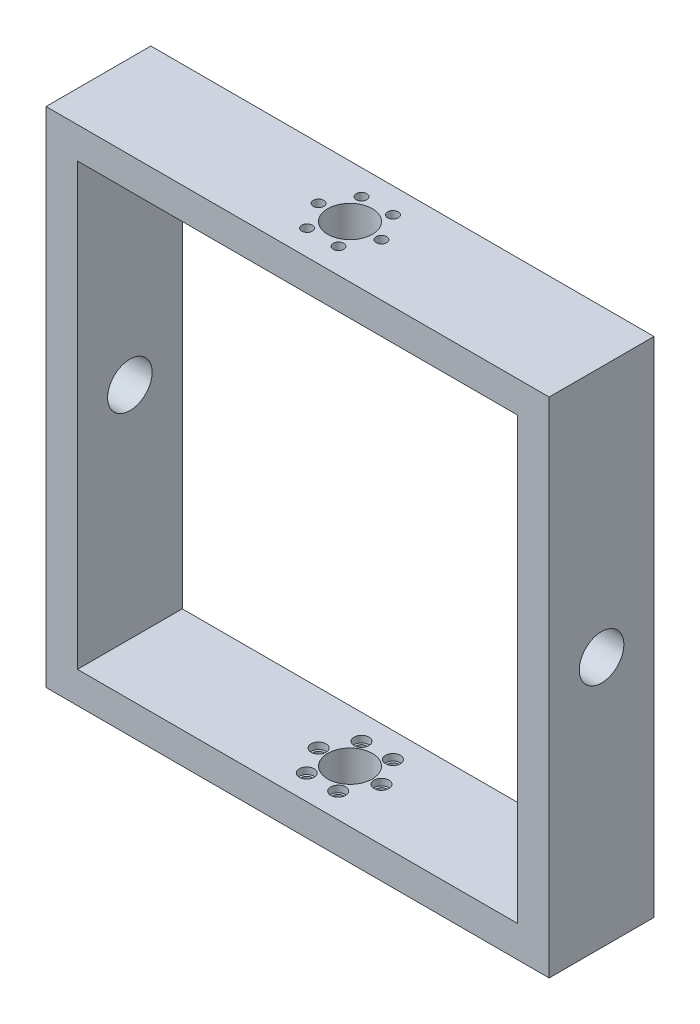
from build123d import *

# Parameters (mm, degrees)
BOSS_EXTRUDE1_DEPTH            = 76.2
BOSS_EXTRUDE1_DEPTH_BACK       = 76.2
SKETCH3_W                      = 152.4
SKETCH3_H                      = 152.4
SKETCH3_W_2                    = 133.35
SKETCH3_H_2                    = 133.35
SKETCH6_W                      = 152.4
SKETCH6_H                      = 120.65
CUT_EXTRUDE1_DEPTH             = 187.6511184
M12_CLEARANCE_HOLE1_D          = 13.5
M12_CLEARANCE_HOLE2_D          = 13.5
CBORE_FOR_M3_SHCS2_D           = 3.2
CBORE_FOR_M3_SHCS2_DEPTH       = 9.525
CBORE_FOR_M3_SHCS2_CBORE_D     = 4.5
CBORE_FOR_M3_SHCS2_CBORE_DEPTH = 2
CBORE_FOR_M3_SHCS3_D           = 3.2
CBORE_FOR_M3_SHCS3_DEPTH       = 9.525
CBORE_FOR_M3_SHCS3_CBORE_D     = 4.5
CBORE_FOR_M3_SHCS3_CBORE_DEPTH = 2


with BuildPart() as part:
    # Sketch3 → Boss-Extrude1 (new, two sides: drawn at the far end of the back side and taken through both)
    with BuildSketch(Plane.XY.offset(-BOSS_EXTRUDE1_DEPTH_BACK)):
        Rectangle(SKETCH3_W, SKETCH3_H)
        Rectangle(SKETCH3_W_2, SKETCH3_H_2, mode=Mode.SUBTRACT)
    extrude(amount=BOSS_EXTRUDE1_DEPTH + BOSS_EXTRUDE1_DEPTH_BACK)

    # Sketch6 → Cut-Extrude1 (cut, through all)
    with BuildSketch(Plane(origin=(0, 76.2, 0), x_dir=(1, 0, 0), z_dir=(0, 1, 0))):
        with Locations((0, 15.875)):
            Rectangle(SKETCH6_W, SKETCH6_H)
    extrude(amount=-CUT_EXTRUDE1_DEPTH, mode=Mode.SUBTRACT)

    # M12 Clearance Hole1 (through all)
    with Locations(Plane(origin=(0, 76.2, 0), x_dir=(1, 0, 0), z_dir=(0, 1, 0))):
        with Locations((0, -60.325)):
            Hole(M12_CLEARANCE_HOLE1_D / 2)

    # M12 Clearance Hole2 (through all)
    with Locations(Plane(origin=(76.2, 0, 0), x_dir=(0, 0, -1), z_dir=(1, 0, 0))):
        with Locations((-60.325, 0)):
            Hole(M12_CLEARANCE_HOLE2_D / 2)

    # CBORE for M3 SHCS2
    with Locations(Plane(origin=(0, 66.675, 0), x_dir=(-1, 0, 0), z_dir=(0, -1, 0))):
        with Locations((-4.7625, -68.573891971), (-4.7625, -52.076108029), (-9.525, -60.325), (9.525, -60.325), (4.7625, -52.076108029), (4.7625, -68.573891971)):
            CounterBoreHole(CBORE_FOR_M3_SHCS2_D / 2, CBORE_FOR_M3_SHCS2_CBORE_D / 2, CBORE_FOR_M3_SHCS2_CBORE_DEPTH, depth=CBORE_FOR_M3_SHCS2_DEPTH)

    # CBORE for M3 SHCS3
    with Locations(Plane(origin=(0, -66.675, 0), x_dir=(1, 0, 0), z_dir=(0, 1, 0))):
        with Locations((4.7625, -52.076108029), (9.525, -60.325), (4.7625, -68.664338764), (-4.7625, -68.664338764), (-9.525, -60.325), (-4.7625, -52.076108029)):
            CounterBoreHole(CBORE_FOR_M3_SHCS3_D / 2, CBORE_FOR_M3_SHCS3_CBORE_D / 2, CBORE_FOR_M3_SHCS3_CBORE_DEPTH, depth=CBORE_FOR_M3_SHCS3_DEPTH)


solid = part.part
